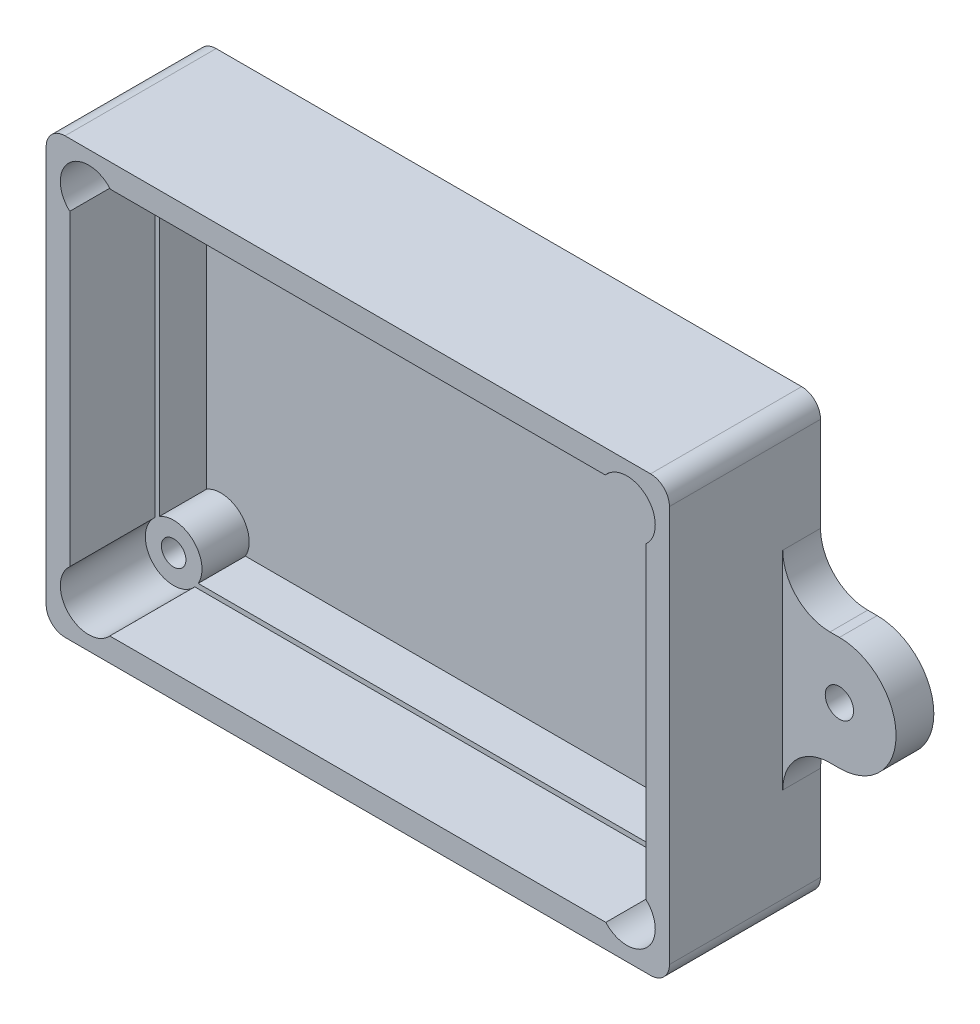
from build123d import *

# Parameters (mm, degrees)
SKETCH1_R           = 1.5
SKETCH1_R_2         = 1.35
SKETCH1_R_3         = 1.3
BOSS_EXTRUDE1_DEPTH = 3
BOSS_EXTRUDE2_START = 2
SKETCH2_W           = 64
SKETCH2_H           = 44
SKETCH2_R           = 1.3
BOSS_EXTRUDE2_DEPTH = 2
SKETCH3_W           = 64
SKETCH3_H           = 44
SKETCH3_W_2         = 60
SKETCH3_H_2         = 40
BOSS_EXTRUDE3_DEPTH = 12
SKETCH4_W           = 61
SKETCH4_H           = 41
SKETCH4_W_2         = 60
SKETCH4_H_2         = 40
CUT_EXTRUDE1_DEPTH  = 9
SKETCH5_R           = 3
CUT_EXTRUDE2_DEPTH  = 9
CUT_EXTRUDE3_START  = -9
CUT_EXTRUDE3_DEPTH  = 9
SKETCH7_W           = 66
SKETCH7_H           = 46
SKETCH7_W_2         = 64
SKETCH7_H_2         = 44
BOSS_EXTRUDE4_DEPTH = 14
SKETCH8_W           = 66
SKETCH8_H           = 46
BOSS_EXTRUDE5_DEPTH = 2
SKETCH9_R           = 6
SKETCH9_R_2         = 1.5
BOSS_EXTRUDE7_DEPTH = 4
FILLET1_R           = 5
FILLET2_R           = 2


with BuildPart() as part:
    # Sketch1 → Boss-Extrude1 (new body)
    # profile 1 of 12: a face of its own
    with BuildSketch(Plane.XY):
        with BuildLine():
            Line((-25.901923789, 20), (-28.5, 20))
            ThreePointArc((-28.5, 20), (-27.439339828, 19.560660172), (-27, 18.5))
            ThreePointArc((-27, 18.5), (-28.5, 17), (-30, 18.5))
            Line((-30, 18.5), (-30, 15.901923789))
            ThreePointArc((-30, 15.901923789), (-27, 15.901923789), (-25.5, 18.5))
            ThreePointArc((-25.5, 18.5), (-25.602222521, 19.276457135), (-25.901923789, 20))
        make_face()
    # profile 2 of 12: a face of its own
    with BuildSketch(Plane.XY):
        with BuildLine():
            Line((28.5, 20), (25.901923789, 20))
            ThreePointArc((25.901923789, 20), (26.378679656, 16.378679656), (30, 15.901923789))
            Line((30, 15.901923789), (30, 18.5))
            ThreePointArc((30, 18.5), (27.439339828, 17.439339828), (28.5, 20))
        make_face()
    # profile 3 of 12: a face of its own
    with BuildSketch(Plane.XY):
        with BuildLine():
            Line((30, -18.5), (30, -15.901923789))
            ThreePointArc((30, -15.901923789), (26.378679656, -16.378679656), (25.901923789, -20))
            Line((25.901923789, -20), (28.5, -20))
            ThreePointArc((28.5, -20), (27.439339828, -17.439339828), (30, -18.5))
        make_face()
    # profile 4 of 12: a face of its own
    with BuildSketch(Plane.XY):
        with BuildLine():
            ThreePointArc((-25.5, -18.5), (-27, -15.901923789), (-30, -15.901923789))
            Line((-30, -15.901923789), (-30, -18.5))
            ThreePointArc((-30, -18.5), (-28.5, -17), (-27, -18.5))
            ThreePointArc((-27, -18.5), (-27.439339828, -19.560660172), (-28.5, -20))
            Line((-28.5, -20), (-25.901923789, -20))
            ThreePointArc((-25.901923789, -20), (-25.602222521, -19.276457135), (-25.5, -18.5))
        make_face()
    # profile 5 of 12: a face of its own
    with BuildSketch(Plane.XY):
        with BuildLine():
            Line((-28.5, 20), (-30, 20))
            Line((-30, 20), (-30, 18.5))
            ThreePointArc((-30, 18.5), (-29.560660172, 19.560660172), (-28.5, 20))
        make_face()
    # profile 6 of 12: a face of its own
    with BuildSketch(Plane.XY):
        with Locations((-28.5, 18.5)):
            Circle(SKETCH1_R)
        with Locations((-28.5, 18.5)):
            Circle(SKETCH1_R_2, mode=Mode.SUBTRACT)
    # profile 7 of 12: a face of its own
    with BuildSketch(Plane.XY):
        with BuildLine():
            Line((30, 20), (28.5, 20))
            ThreePointArc((28.5, 20), (29.560660172, 19.560660172), (30, 18.5))
            Line((30, 18.5), (30, 20))
        make_face()
    # profile 8 of 12: a face of its own
    with BuildSketch(Plane.XY):
        with Locations((28.5, 18.5)):
            Circle(SKETCH1_R)
        with Locations((28.5, 18.5)):
            Circle(SKETCH1_R_3, mode=Mode.SUBTRACT)
    # profile 9 of 12: a face of its own
    with BuildSketch(Plane.XY):
        with BuildLine():
            Line((30, -20), (30, -18.5))
            ThreePointArc((30, -18.5), (29.560660172, -19.560660172), (28.5, -20))
            Line((28.5, -20), (30, -20))
        make_face()
    # profile 10 of 12: a face of its own
    with BuildSketch(Plane.XY):
        with Locations((28.5, -18.5)):
            Circle(SKETCH1_R)
        with Locations((28.5, -18.5)):
            Circle(SKETCH1_R_3, mode=Mode.SUBTRACT)
    # profile 11 of 12: a face of its own
    with BuildSketch(Plane.XY):
        with BuildLine():
            ThreePointArc((-28.5, -20), (-29.560660172, -19.560660172), (-30, -18.5))
            Line((-30, -18.5), (-30, -20))
            Line((-30, -20), (-28.5, -20))
        make_face()
    # profile 12 of 12: a face of its own
    with BuildSketch(Plane.XY):
        with Locations((-28.5, -18.5)):
            Circle(SKETCH1_R)
        with Locations((-28.5, -18.5)):
            Circle(SKETCH1_R_3, mode=Mode.SUBTRACT)
    extrude(amount=BOSS_EXTRUDE1_DEPTH)

    # Sketch2 → Boss-Extrude2 (add)
    # profile 1 of 4: a face of its own
    with BuildSketch(Plane(origin=(0, 0, 0), x_dir=(-1, 0, 0), z_dir=(0, 0, -1)).offset(BOSS_EXTRUDE2_START)):
        Rectangle(SKETCH2_W, SKETCH2_H)
        Polygon((-30, 15.901923789), (-30, 20), (-25.901923789, 20), (30, 20), (30, -20), (-30, -20), align=None, mode=Mode.SUBTRACT)
    # profile 2 of 4: a face of its own
    with BuildSketch(Plane(origin=(0, 0, 0), x_dir=(-1, 0, 0), z_dir=(0, 0, -1)).offset(BOSS_EXTRUDE2_START)):
        with BuildLine():
            Line((30, 20), (-25.901923789, 20))
            ThreePointArc((-25.901923789, 20), (-26.378679656, 16.378679656), (-30, 15.901923789))
            Line((-30, 15.901923789), (-30, -20))
            Line((-30, -20), (30, -20))
            Line((30, -20), (30, 20))
        make_face()
    # profile 3 of 4: a face of its own
    with BuildSketch(Plane(origin=(0, 0, 0), x_dir=(-1, 0, 0), z_dir=(0, 0, -1)).offset(BOSS_EXTRUDE2_START)):
        with BuildLine():
            ThreePointArc((-30, 15.901923789), (-26.378679656, 16.378679656), (-25.901923789, 20))
            Line((-25.901923789, 20), (-30, 20))
            Line((-30, 20), (-30, 15.901923789))
        make_face()
        with Locations(Location((-28.5, 18.5, 0), (0, 0, 180))):
            Circle(SKETCH2_R, mode=Mode.SUBTRACT)
    # profile 4 of 4: a face of its own
    with BuildSketch(Plane(origin=(0, 0, 0), x_dir=(-1, 0, 0), z_dir=(0, 0, -1)).offset(BOSS_EXTRUDE2_START)):
        with Locations(Location((-28.5, 18.5, 0), (0, 0, 180))):
            Circle(SKETCH2_R)
    extrude(amount=-BOSS_EXTRUDE2_DEPTH)

    # Sketch3 → Boss-Extrude3 (add)
    with BuildSketch(Plane.XY):
        Rectangle(SKETCH3_W, SKETCH3_H)
        Rectangle(SKETCH3_W_2, SKETCH3_H_2, mode=Mode.SUBTRACT)
    extrude(amount=BOSS_EXTRUDE3_DEPTH)

    # Sketch4 → Cut-Extrude1 (cut)
    with BuildSketch(Plane.XY.offset(12)):
        Rectangle(SKETCH4_W, SKETCH4_H)
        Rectangle(SKETCH4_W_2, SKETCH4_H_2, mode=Mode.SUBTRACT)
    extrude(amount=-CUT_EXTRUDE1_DEPTH, mode=Mode.SUBTRACT)

    # Sketch5 → Cut-Extrude2 (cut)
    with BuildSketch(Plane.XY.offset(3)):
        with Locations((28.5, -18.5)):
            Circle(SKETCH5_R)
        with Locations((-28.5, -18.5)):
            Circle(SKETCH5_R)
        with Locations((-28.5, 18.564453257)):
            Circle(SKETCH5_R)
        with Locations((28.5, 18.564453257)):
            Circle(SKETCH5_R)
    extrude(amount=CUT_EXTRUDE2_DEPTH, mode=Mode.SUBTRACT)

    # Sketch6 → Cut-Extrude3 (cut)
    with BuildSketch(Plane.XY.offset(CUT_EXTRUDE3_START)):
        with BuildLine():
            Line((30, -15.901923789), (30, 15.901923789))
            ThreePointArc((30, 15.901923789), (26.378679656, 16.378679656), (25.901923789, 20))
            Line((25.901923789, 20), (-25.901923789, 20))
            ThreePointArc((-25.901923789, 20), (-26.378679656, 16.378679656), (-30, 15.901923789))
            Line((-30, 15.901923789), (-30, -15.901923789))
            ThreePointArc((-30, -15.901923789), (-26.378679656, -16.378679656), (-25.901923789, -20))
            Line((-25.901923789, -20), (25.901923789, -20))
            ThreePointArc((25.901923789, -20), (26.378679656, -16.378679656), (30, -15.901923789))
        make_face()
    extrude(amount=CUT_EXTRUDE3_DEPTH, mode=Mode.SUBTRACT)

    # Sketch7 → Boss-Extrude4 (add)
    with BuildSketch(Plane(origin=(0, 0, -2), x_dir=(-1, 0, 0), z_dir=(0, 0, -1))):
        Rectangle(SKETCH7_W, SKETCH7_H)
        Rectangle(SKETCH7_W_2, SKETCH7_H_2, mode=Mode.SUBTRACT)
    extrude(amount=-BOSS_EXTRUDE4_DEPTH)

    # Sketch8 → Boss-Extrude5 (add)
    with BuildSketch(Plane(origin=(0, 0, -2), x_dir=(-1, 0, 0), z_dir=(0, 0, -1))):
        Rectangle(SKETCH8_W, SKETCH8_H)
    extrude(amount=BOSS_EXTRUDE5_DEPTH)

    # Sketch9 → Boss-Extrude7 (add)
    # profile 1 of 6: a face of its own
    with BuildSketch(Plane(origin=(0, 0, -4), x_dir=(-1, 0, 0), z_dir=(0, 0, -1))):
        with Locations((39, 0)):
            Circle(SKETCH9_R)
        with Locations((39, 0)):
            Circle(SKETCH9_R_2, mode=Mode.SUBTRACT)
    # profile 2 of 6: a face of its own
    with BuildSketch(Plane(origin=(0, 0, -4), x_dir=(-1, 0, 0), z_dir=(0, 0, -1))):
        with BuildLine():
            ThreePointArc((33, 1e-09), (34.757359313, 4.242640687), (39, 6))
            Line((39, 6), (33, 6))
            Line((33, 6), (33, 1e-09))
        make_face()
    # profile 3 of 6: a face of its own
    with BuildSketch(Plane(origin=(0, 0, -4), x_dir=(-1, 0, 0), z_dir=(0, 0, -1))):
        with BuildLine():
            ThreePointArc((39, -6), (34.757359313, -4.242640687), (33, 1e-09))
            Line((33, 1e-09), (33, -6))
            Line((33, -6), (39, -6))
        make_face()
    # profile 4 of 6: a face of its own
    with BuildSketch(Plane(origin=(0, 0, -4), x_dir=(-1, 0, 0), z_dir=(0, 0, -1))):
        with Locations((-39, 0)):
            Circle(SKETCH9_R)
        with Locations((-39, 0)):
            Circle(SKETCH9_R_2, mode=Mode.SUBTRACT)
    # profile 5 of 6: a face of its own
    with BuildSketch(Plane(origin=(0, 0, -4), x_dir=(-1, 0, 0), z_dir=(0, 0, -1))):
        with BuildLine():
            Line((-33, 0), (-33, 6))
            Line((-33, 6), (-39, 6))
            ThreePointArc((-39, 6), (-34.757359313, 4.242640687), (-33, 0))
        make_face()
    # profile 6 of 6: a face of its own
    with BuildSketch(Plane(origin=(0, 0, -4), x_dir=(-1, 0, 0), z_dir=(0, 0, -1))):
        with BuildLine():
            Line((-33, -6), (-33, 0))
            ThreePointArc((-33, 0), (-34.757359313, -4.242640687), (-39, -6))
            Line((-39, -6), (-33, -6))
        make_face()
    extrude(amount=-BOSS_EXTRUDE7_DEPTH)

    # Fillet1
    fillet1_edges = [part.edges().sort_by_distance(p)[0] for p in [
        (-33, 6, -2),
        (-33, -6, -2),
        (33, -6, -2),
        (33, 6, -2),
    ]]
    fillet(fillet1_edges, radius=FILLET1_R)

    # Fillet2
    fillet2_edges = [part.edges().sort_by_distance(p)[0] for p in [
        (-33, 23, 4),
        (33, -23, 4),
        (-33, -23, 4),
        (33, 23, 4),
    ]]
    fillet(fillet2_edges, radius=FILLET2_R)


solid = part.part
